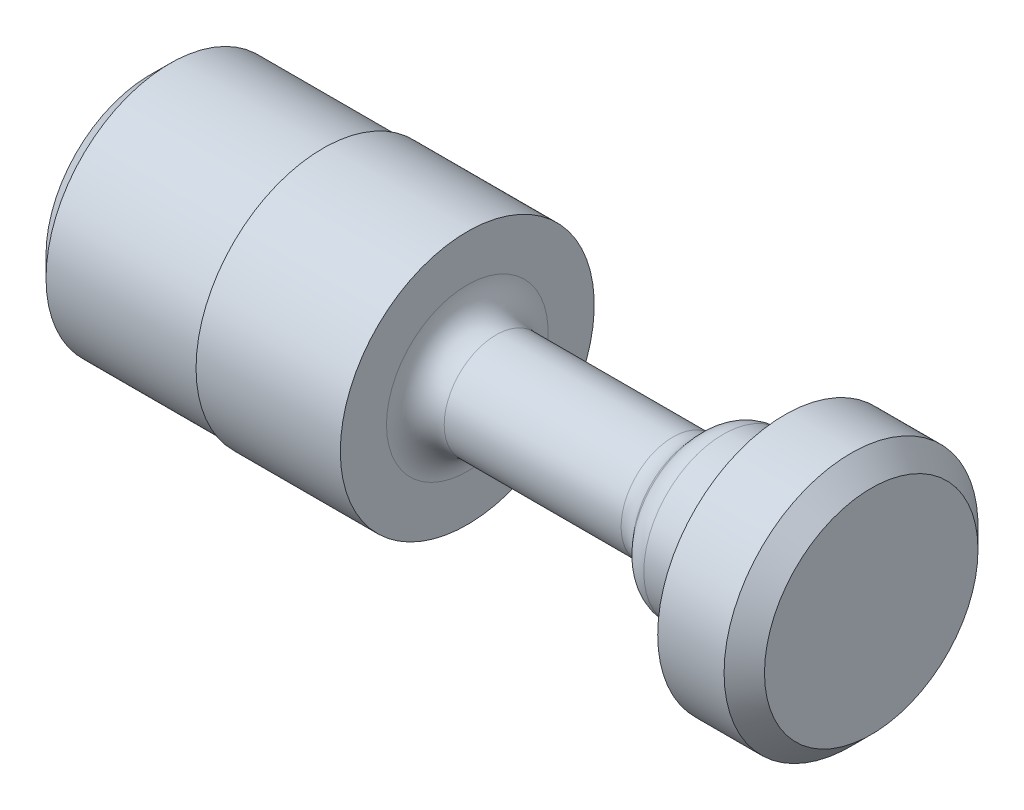
from build123d import *


with BuildPart() as part:
    # Esquisse1 → Révolution1 (revolve)
    with BuildSketch(Plane.XY):
        with BuildLine():
            Line((-6.5, 4.4), (-6.5, 4.3))
            Line((-6.5, 4.3), (-11.8, 4.3))
            Line((-11.8, 4.3), (-12.5, 3.6))
            Line((-12.5, 3.6), (-12.5, 0))
            Line((-12.5, 0), (12.5, 0))
            Line((12.5, 0), (12.5, 3.7))
            Line((12.5, 3.7), (11.8, 4.4))
            Line((11.8, 4.4), (9.5, 4.4))
            Line((9.5, 4.4), (9.5, 3.55))
            ThreePointArc((9.5, 3.55), (9.265685425, 2.984314575), (8.7, 2.75))
            Line((8.7, 2.75), (7.368165998, 2.75))
            ThreePointArc((7.368165998, 2.75), (6.954414959, 2.660390069), (6.614816325, 2.407620157))
            Line((6.614816325, 2.407620157), (6.383280582, 2.142379843))
            ThreePointArc((6.383280582, 2.142379843), (6.043681947, 1.889609931), (5.629930909, 1.8))
            Line((5.629930909, 1.8), (-0.5, 1.8))
            ThreePointArc((-0.5, 1.8), (-1.207106781, 2.092893219), (-1.5, 2.8))
            Line((-1.5, 2.8), (-1.5, 4.4))
            Line((-1.5, 4.4), (-6.5, 4.4))
        make_face()
    revolve(axis=Axis((-13.47216, 0, 0), (1, 0, 0)))


solid = part.part
